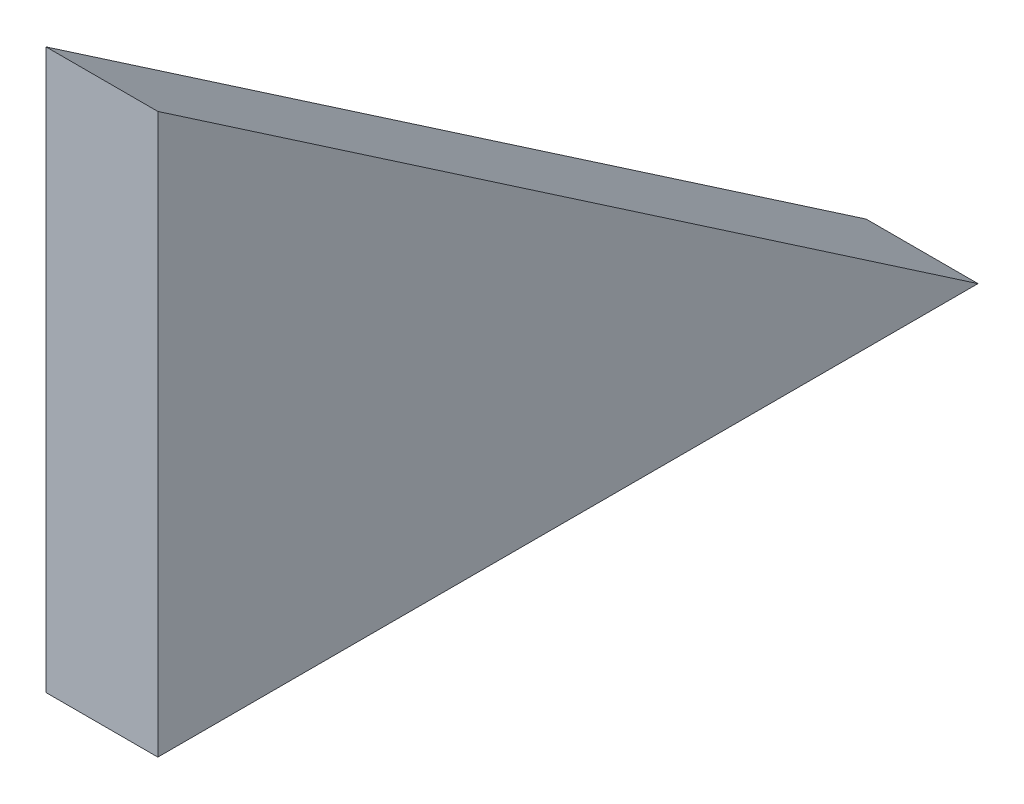
from build123d import *

# Parameters (mm, degrees)
BOSS_EXTRUDE1_DEPTH = 3


with BuildPart() as part:
    # Sketch1 → Boss-Extrude1 (new body)
    with BuildSketch(Plane(origin=(0, 0, 0), x_dir=(0, 0, -1), z_dir=(1, 0, 0))):
        Polygon((0, 9.987301587), (0, 15), (22, 0), (0, 0), align=None)
    extrude(amount=BOSS_EXTRUDE1_DEPTH)


solid = part.part
